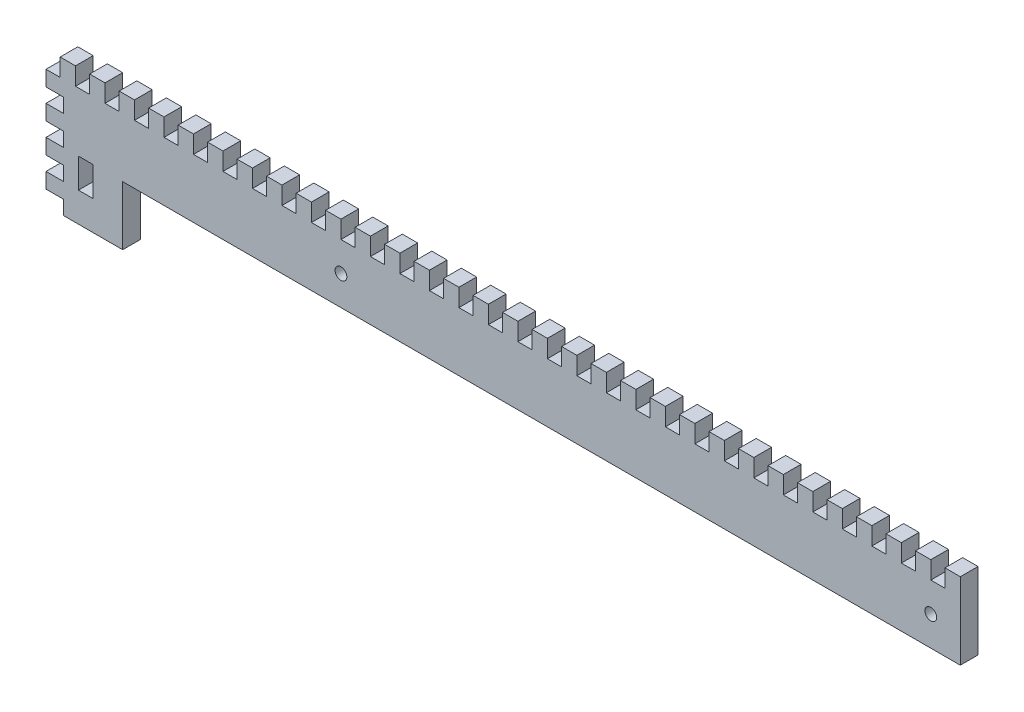
from build123d import *

# Parameters (mm, degrees)
ESQUISSE1_R        = 2
ESQUISSE1_W        = 5
ESQUISSE1_H        = 10
BOSS_EXTRU_1_DEPTH = 6


with BuildPart() as part:
    # Esquisse1 → Boss.-Extru.1 (new body)
    with BuildSketch(Plane.XY):
        Polygon((0, 0), (0, 26), (-5.2, 26), (-5.2, 20), (-10, 20), (-10, 26), (-15.2, 26), (-15.2, 20), (-20, 20), (-20, 26), (-25.2, 26), (-25.2, 20), (-30, 20), (-30, 26), (-35.2, 26), (-35.2, 20), (-40, 20), (-40, 26), (-45.2, 26), (-45.2, 20), (-50, 20), (-50, 26), (-55.2, 26), (-55.2, 20), (-60, 20), (-60, 26), (-65.2, 26), (-65.2, 20), (-70, 20), (-70, 26), (-75.2, 26), (-75.2, 20), (-80, 20), (-80, 26), (-85.2, 26), (-85.2, 20), (-90, 20), (-90, 26), (-95.2, 26), (-95.2, 20), (-100, 20), (-100, 26), (-105.2, 26), (-105.2, 20), (-110, 20), (-110, 26), (-115.2, 26), (-115.2, 20), (-120, 20), (-120, 26), (-125.2, 26), (-125.2, 20), (-130, 20), (-130, 26), (-135.2, 26), (-135.2, 20), (-140, 20), (-140, 26), (-145.2, 26), (-145.2, 20), (-150, 20), (-150, 26), (-155.2, 26), (-155.2, 20), (-160, 20), (-160, 26), (-165.2, 26), (-165.2, 20), (-170, 20), (-170, 26), (-175.2, 26), (-175.2, 20), (-180, 20), (-180, 26), (-185.2, 26), (-185.2, 20), (-190, 20), (-190, 26), (-195.2, 26), (-195.2, 20), (-200, 20), (-200, 26), (-205.2, 26), (-205.2, 20), (-210, 20), (-210, 26), (-215.2, 26), (-215.2, 20), (-220, 20), (-220, 26), (-225.2, 26), (-225.2, 20), (-230, 20), (-230, 26), (-235.2, 26), (-235.2, 20), (-240, 20), (-240, 26), (-245.2, 26), (-245.2, 20), (-250, 20), (-250, 26), (-255.2, 26), (-255.2, 20), (-260, 20), (-260, 26), (-265.2, 26), (-265.2, 20), (-270, 20), (-270, 26), (-275.2, 26), (-275.2, 20), (-280, 20), (-280, 26), (-285.2, 26), (-285.2, 20), (-290, 20), (-290, 26), (-295.2, 26), (-295.2, 20), (-300, 20), (-300, 26), (-305.2, 26), (-305.2, 20), (-310, 20), (-310, 14.8), (-304, 14.8), (-304, 10), (-310, 10), (-310, 4.8), (-304, 4.8), (-304, 0), (-310, 0), (-310, -5.2), (-304, -5.2), (-304, -10), (-310, -10), (-310, -15.2), (-304, -15.2), (-304, -20), (-284, -20), (-284, 0), align=None)
        with Locations((-210, 10)):
            Circle(ESQUISSE1_R, mode=Mode.SUBTRACT)
        with Locations((-10, 10)):
            Circle(ESQUISSE1_R, mode=Mode.SUBTRACT)
        with Locations((-296.5, -5)):
            Rectangle(ESQUISSE1_W, ESQUISSE1_H, mode=Mode.SUBTRACT)
    extrude(amount=BOSS_EXTRU_1_DEPTH)


solid = part.part
